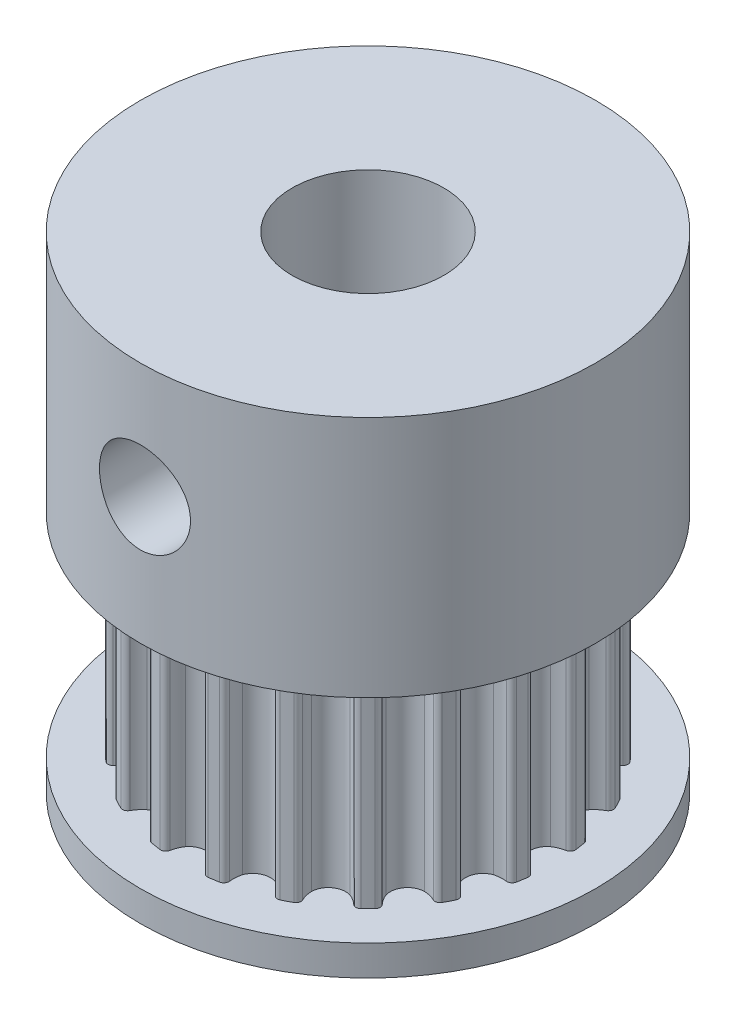
from build123d import *

# Parameters (mm, degrees)
SKETCH1_R                = 6.112203101
BOSS_EXTRUDE1_DEPTH      = 7
CUT_EXTRUDE1_START       = -10
CUT_EXTRUDE1_DEPTH       = 10
FILLET1_R                = 0.17
CIRPATTERN2_COUNT        = 20
FILLET1_OF_CIRPATTERN2_R = 0.17
SKETCH3_R                = 7.5
BOSS_EXTRUDE2_DEPTH      = 8
BOSS_EXTRUDE3_START      = 1
SKETCH4_R                = 7.5
BOSS_EXTRUDE3_DEPTH      = 1
SKETCH6_R                = 2.5
CUT_EXTRUDE2_DEPTH       = 20.196353899
CUT_EXTRUDE3_REACH       = 24.5
SKETCH7_R                = 1.5


with BuildPart() as part:
    # Sketch1 → Boss-Extrude1 (new body)
    with BuildSketch(Plane(origin=(0, 0, 0), x_dir=(1, 0, 0), z_dir=(0, 1, 0))):
        Circle(SKETCH1_R)
    extrude(amount=BOSS_EXTRUDE1_DEPTH)

    # Sketch2 → Cut-Extrude1 (cut)
    with BuildSketch(Plane(origin=(0, 7, 0), x_dir=(1, 0, 0), z_dir=(0, 1, 0)).offset(CUT_EXTRUDE1_START)):
        with BuildLine():
            ThreePointArc((0.453553699, 5.553771294), (0.572890618, 5.805798391), (0.619514195, 6.080726018))
            ThreePointArc((0.619514195, 6.080726018), (0, 6.112203101), (-0.619514195, 6.080726018))
            ThreePointArc((-0.619514195, 6.080726018), (-0.572890618, 5.805798391), (-0.453553699, 5.553771294))
            ThreePointArc((-0.453553699, 5.553771294), (0, 5.332203101), (0.453553699, 5.553771294))
        make_face()
    cut_extrude1 = extrude(amount=CUT_EXTRUDE1_DEPTH, mode=Mode.SUBTRACT)

    # Fillet1
    fillet1_edges = [part.edges().sort_by_distance(p)[0] for p in [
        (0.619514195, 3.5, -6.080726018),
        (-0.619514195, 3.5, -6.080726018),
    ]]
    fillet(fillet1_edges, radius=FILLET1_R)

    # CirPattern2: Cut-Extrude1 ×20 about axis
    cirpattern2_axis = Axis((0, 7, 0), (0, -1, 0))
    for i in range(1, CIRPATTERN2_COUNT):
        add(cut_extrude1.rotate(cirpattern2_axis, i * 360 / CIRPATTERN2_COUNT), mode=Mode.SUBTRACT)

    # Fillet1 of CirPattern2
    fillet1_of_cirpattern2_edges = [part.edges().sort_by_distance(p)[0] for p in [
        (2.46824069, 3.5, -5.591673689),
        (1.289854666, 3.5, -5.974554518),
        (4.075358589, 3.5, -4.55526938),
        (3.072963565, 3.5, -5.283551994),
        (5.283551994, 3.5, -3.072963565),
        (4.55526938, 3.5, -4.075358589),
        (5.974554518, 3.5, -1.289854666),
        (5.591673689, 3.5, -2.46824069),
        (6.080726018, 3.5, 0.619514195),
        (6.080726018, 3.5, -0.619514195),
        (5.591673689, 3.5, 2.46824069),
        (5.974554518, 3.5, 1.289854666),
        (4.55526938, 3.5, 4.075358589),
        (5.283551994, 3.5, 3.072963565),
        (3.072963565, 3.5, 5.283551994),
        (4.075358589, 3.5, 4.55526938),
        (1.289854666, 3.5, 5.974554518),
        (2.46824069, 3.5, 5.591673689),
        (-0.619514195, 3.5, 6.080726018),
        (0.619514195, 3.5, 6.080726018),
        (-2.46824069, 3.5, 5.591673689),
        (-1.289854666, 3.5, 5.974554518),
        (-4.075358589, 3.5, 4.55526938),
        (-3.072963565, 3.5, 5.283551994),
        (-5.283551994, 3.5, 3.072963565),
        (-4.55526938, 3.5, 4.075358589),
        (-5.974554518, 3.5, 1.289854666),
        (-5.591673689, 3.5, 2.46824069),
        (-6.080726018, 3.5, -0.619514195),
        (-6.080726018, 3.5, 0.619514195),
        (-5.591673689, 3.5, -2.46824069),
        (-5.974554518, 3.5, -1.289854666),
        (-4.55526938, 3.5, -4.075358589),
        (-5.283551994, 3.5, -3.072963565),
        (-3.072963565, 3.5, -5.283551994),
        (-4.075358589, 3.5, -4.55526938),
        (-1.289854666, 3.5, -5.974554518),
        (-2.46824069, 3.5, -5.591673689),
    ]]
    fillet(fillet1_of_cirpattern2_edges, radius=FILLET1_OF_CIRPATTERN2_R)

    # Sketch3 → Boss-Extrude2 (add)
    with BuildSketch(Plane(origin=(0, 7, 0), x_dir=(1, 0, 0), z_dir=(0, 1, 0))):
        Circle(SKETCH3_R)
    extrude(amount=BOSS_EXTRUDE2_DEPTH)

    # Sketch4 → Boss-Extrude3 (add)
    with BuildSketch(Plane.XZ.offset(BOSS_EXTRUDE3_START)):
        Circle(SKETCH4_R)
    extrude(amount=-BOSS_EXTRUDE3_DEPTH)

    # Sketch6 → Cut-Extrude2 (cut, through all)
    with BuildSketch(Plane(origin=(0, 15, 0), x_dir=(1, 0, 0), z_dir=(0, 1, 0))):
        Circle(SKETCH6_R)
    extrude(amount=-CUT_EXTRUDE2_DEPTH, mode=Mode.SUBTRACT)

    # Sketch7 → Cut-Extrude3 (cut, up to next)
    with BuildSketch(Plane.XY.offset(7.5), mode=Mode.PRIVATE) as cut_extrude3_sk1:
        with Locations((0, 11.169295652)):
            Circle(SKETCH7_R)
    cut_extrude3_tool1 = extrude(cut_extrude3_sk1.sketch, amount=-CUT_EXTRUDE3_REACH, mode=Mode.PRIVATE) & part.part
    add(cut_extrude3_tool1.solids().sort_by_distance((0, 11.169296, 7.5))[0], mode=Mode.SUBTRACT)


solid = part.part
